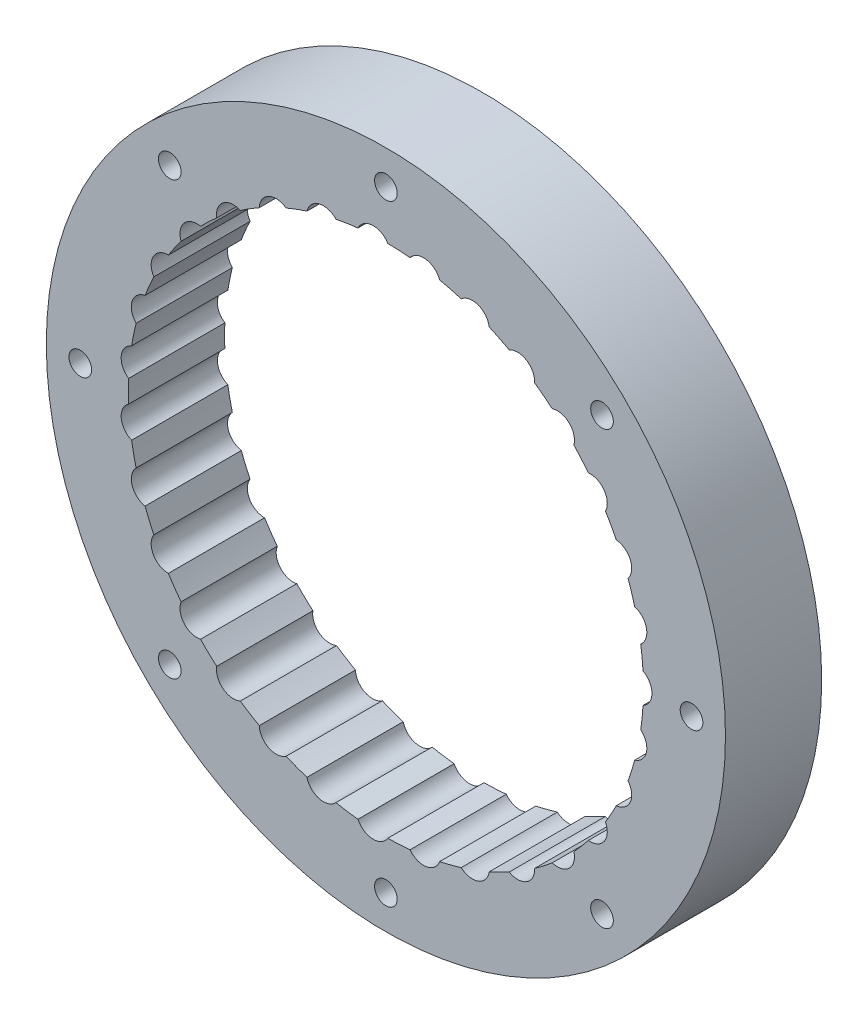
from build123d import *

# Parameters (mm, degrees)
BOSS_EXTRUDE1_DEPTH = 17
SKETCH2_R           = 2
CUT_EXTRUDE1_DEPTH  = 89.658793805
CUT_EXTRUDE2_START  = -30
SKETCH3_R           = 75.542453457
SKETCH3_R_2         = 60
CUT_EXTRUDE2_DEPTH  = 30


with BuildPart() as part:
    # Sketch1 → Boss-Extrude1 (new body)
    with BuildSketch(Plane.XY):
        with BuildLine():
            ThreePointArc((59.924052039, 3.017944215), (-60, 0), (59.924052039, -3.017944215))
            ThreePointArc((59.924052039, -3.017944215), (63.018899696, 0), (59.924052039, 3.017944215))
        make_face()
        with BuildLine():
            ThreePointArc((45.423295455, -2.640876758), (47, 0), (45.423295455, 2.640876758))
            ThreePointArc((45.423295455, 2.640876758), (45.266554214, 4.60315865), (45.025082511, 6.556824297))
            ThreePointArc((45.025082511, 6.556824297), (46.037907239, 9.461030444), (43.961873345, 11.730460008))
            ThreePointArc((43.961873345, 11.730460008), (43.413336166, 13.621022095), (42.783537399, 15.486088195))
            ThreePointArc((42.783537399, 15.486088195), (43.191017146, 18.53472519), (40.700646975, 20.339796847))
            ThreePointArc((40.700646975, 20.339796847), (39.782771035, 22.081239295), (38.79042924, 23.781349823))
            ThreePointArc((38.79042924, 23.781349823), (38.575881737, 26.849606109), (35.773131337, 28.116420013))
            ThreePointArc((35.773131337, 28.116420013), (34.523494583, 29.637447964), (33.209236349, 31.103000194))
            ThreePointArc((33.209236349, 31.103000194), (32.381445197, 34.065261), (29.381059498, 34.741953641))
            ThreePointArc((29.381059498, 34.741953641), (27.850822206, 35.980296031), (26.268453421, 37.151290083))
            ThreePointArc((26.268453421, 37.151290083), (24.861308485, 39.886280102), (21.786123631, 39.945147604))
            ThreePointArc((21.786123631, 39.945147604), (20.037933896, 40.85010655), (18.252236923, 41.678601792))
            ThreePointArc((18.252236923, 41.678601792), (16.323346884, 44.074350211), (13.299261303, 43.512982532))
            ThreePointArc((13.299261303, 43.512982532), (11.404690218, 44.047508908), (9.488771701, 44.499586645))
            ThreePointArc((9.488771701, 44.499586645), (7.117105543, 46.458011243), (4.267925654, 45.299390841))
            ThreePointArc((4.267925654, 45.299390841), (2.304537182, 45.441601076), (0.336835051, 45.498753193))
            ThreePointArc((0.336835051, 45.498753193), (-2.380510935, 46.939675837), (-4.938139372, 45.231236768))
            ThreePointArc((-4.938139372, 45.231236768), (-6.889963876, 44.975308757), (-8.828891666, 44.63519544))
            ThreePointArc((-8.828891666, 44.63519544), (-11.780669016, 45.499624587), (-13.942036392, 43.311310546))
            ThreePointArc((-13.942036392, 43.311310546), (-15.802389004, 42.667722013), (-17.633162521, 41.94426754))
            ThreePointArc((-17.633162521, 41.94426754), (-20.698525123, 42.19681336), (-22.375144804, 39.618214182))
            ThreePointArc((-22.375144804, 39.618214182), (-24.06786247, 38.613313716), (-25.715529631, 37.5361364))
            ThreePointArc((-25.715529631, 37.5361364), (-28.76898118, 37.166459636), (-29.892212159, 34.303143475))
            ThreePointArc((-29.892212159, 34.303143475), (-31.347994818, 32.978071819), (-32.745099935, 31.591271425))
            ThreePointArc((-32.745099935, 31.591271425), (-35.661631767, 30.614506688), (-36.185488836, 27.583698043))
            ThreePointArc((-36.185488836, 27.583698043), (-37.344736575, 25.992703787), (-38.434082002, 24.353056085))
            ThreePointArc((-38.434082002, 24.353056085), (-41.094290959, 22.809192239), (-40.997327348, 19.734972772))
            ThreePointArc((-40.997327348, 19.734972772), (-41.812580429, 17.943191408), (-42.549568235, 16.117823769))
            ThreePointArc((-42.549568235, 16.117823769), (-44.844545051, 14.07006678), (-44.130730462, 11.078295397))
            ThreePointArc((-44.130730462, 11.078295397), (-44.568612327, 9.159082664), (-44.923070145, 7.222725853))
            ThreePointArc((-44.923070145, 7.222725853), (-46.758858199, 4.754911133), (-45.457416285, 1.968071307))
            ThreePointArc((-45.457416285, 1.968071307), (-45.5, 0), (-45.457416285, -1.968071307))
            ThreePointArc((-45.457416285, -1.968071307), (-46.758858199, -4.754911133), (-44.923070145, -7.222725853))
            ThreePointArc((-44.923070145, -7.222725853), (-44.568612327, -9.159082664), (-44.130730462, -11.078295397))
            ThreePointArc((-44.130730462, -11.078295397), (-44.844545051, -14.07006678), (-42.549568235, -16.117823769))
            ThreePointArc((-42.549568235, -16.117823769), (-41.812580429, -17.943191408), (-40.997327348, -19.734972772))
            ThreePointArc((-40.997327348, -19.734972772), (-41.094290959, -22.809192239), (-38.434082002, -24.353056085))
            ThreePointArc((-38.434082002, -24.353056085), (-37.344736575, -25.992703787), (-36.185488836, -27.583698043))
            ThreePointArc((-36.185488836, -27.583698043), (-35.661631767, -30.614506688), (-32.745099935, -31.591271425))
            ThreePointArc((-32.745099935, -31.591271425), (-31.347994818, -32.978071819), (-29.892212159, -34.303143475))
            ThreePointArc((-29.892212159, -34.303143475), (-28.76898118, -37.166459636), (-25.715529631, -37.5361364))
            ThreePointArc((-25.715529631, -37.5361364), (-24.06786247, -38.613313716), (-22.375144804, -39.618214182))
            ThreePointArc((-22.375144804, -39.618214182), (-20.698525123, -42.19681336), (-17.633162521, -41.94426754))
            ThreePointArc((-17.633162521, -41.94426754), (-15.802389004, -42.667722013), (-13.942036392, -43.311310546))
            ThreePointArc((-13.942036392, -43.311310546), (-11.780669016, -45.499624587), (-8.828891666, -44.63519544))
            ThreePointArc((-8.828891666, -44.63519544), (-6.889963876, -44.975308757), (-4.938139372, -45.231236768))
            ThreePointArc((-4.938139372, -45.231236768), (-2.380510935, -46.939675837), (0.336835051, -45.498753193))
            ThreePointArc((0.336835051, -45.498753193), (2.304537182, -45.441601076), (4.267925654, -45.299390841))
            ThreePointArc((4.267925654, -45.299390841), (7.117105543, -46.458011243), (9.488771701, -44.499586645))
            ThreePointArc((9.488771701, -44.499586645), (11.404690218, -44.047508908), (13.299261303, -43.512982532))
            ThreePointArc((13.299261303, -43.512982532), (16.323346884, -44.074350211), (18.252236923, -41.678601792))
            ThreePointArc((18.252236923, -41.678601792), (20.037933896, -40.85010655), (21.786123631, -39.945147604))
            ThreePointArc((21.786123631, -39.945147604), (24.861308485, -39.886280102), (26.268453421, -37.151290083))
            ThreePointArc((26.268453421, -37.151290083), (27.850822206, -35.980296031), (29.381059498, -34.741953641))
            ThreePointArc((29.381059498, -34.741953641), (32.381445197, -34.065261), (33.209236349, -31.103000194))
            ThreePointArc((33.209236349, -31.103000194), (34.523494583, -29.637447964), (35.773131337, -28.116420013))
            ThreePointArc((35.773131337, -28.116420013), (38.575881737, -26.849606109), (38.79042924, -23.781349823))
            ThreePointArc((38.79042924, -23.781349823), (39.782771035, -22.081239295), (40.700646975, -20.339796847))
            ThreePointArc((40.700646975, -20.339796847), (43.191017146, -18.53472519), (42.783537399, -15.486088195))
            ThreePointArc((42.783537399, -15.486088195), (43.413336166, -13.621022095), (43.961873345, -11.730460008))
            ThreePointArc((43.961873345, -11.730460008), (46.037907239, -9.461030444), (45.025082511, -6.556824297))
            ThreePointArc((45.025082511, -6.556824297), (45.266554214, -4.60315865), (45.423295455, -2.640876758))
        make_face(mode=Mode.SUBTRACT)
    extrude(amount=BOSS_EXTRUDE1_DEPTH)

    # Sketch2 → Cut-Extrude1 (cut, through all)
    with BuildSketch(Plane.XY.offset(17)):
        with Locations((0, 54)):
            Circle(SKETCH2_R)
        with Locations((38.183766184, 38.183766184)):
            Circle(SKETCH2_R)
        with Locations((54, 0)):
            Circle(SKETCH2_R)
        with Locations((38.183766184, -38.183766184)):
            Circle(SKETCH2_R)
        with Locations((0, -54)):
            Circle(SKETCH2_R)
        with Locations((-38.183766184, -38.183766184)):
            Circle(SKETCH2_R)
        with Locations((-54, 0)):
            Circle(SKETCH2_R)
        with Locations((-38.183766184, 38.183766184)):
            Circle(SKETCH2_R)
    extrude(amount=-CUT_EXTRUDE1_DEPTH, mode=Mode.SUBTRACT)

    # Sketch3 → Cut-Extrude2 (cut)
    with BuildSketch(Plane.XY.offset(17).offset(CUT_EXTRUDE2_START)):
        Circle(SKETCH3_R)
        Circle(SKETCH3_R_2, mode=Mode.SUBTRACT)
    extrude(amount=CUT_EXTRUDE2_DEPTH, mode=Mode.SUBTRACT)


solid = part.part
